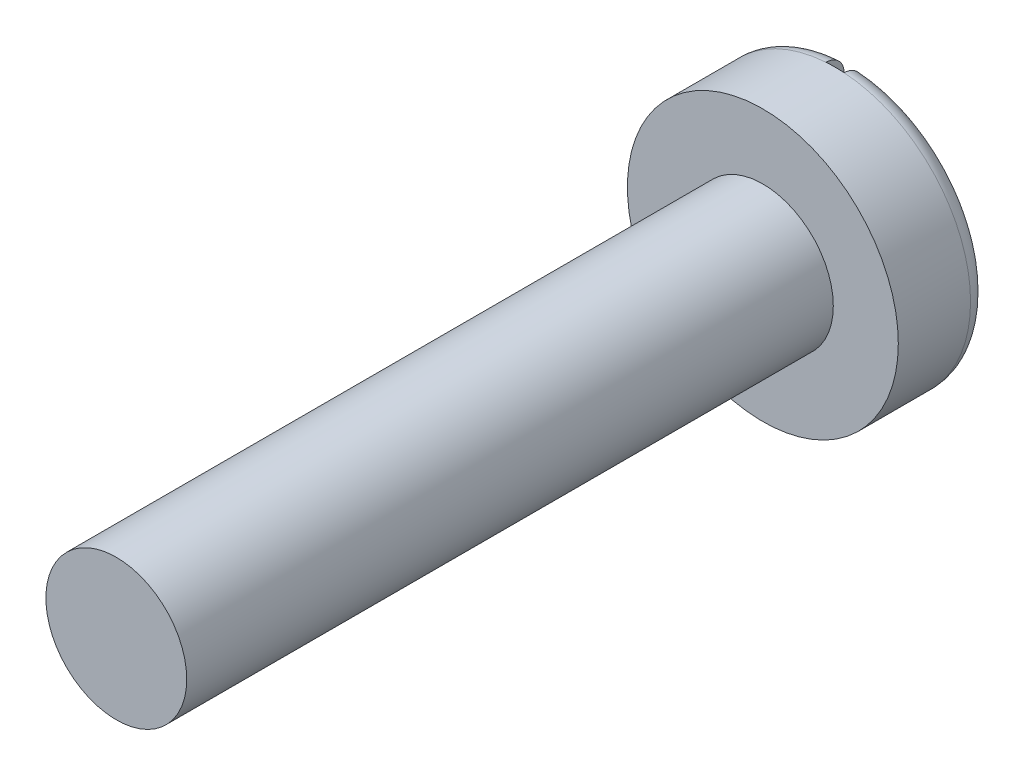
from build123d import *

# Parameters (mm, degrees)
CUT_EXTRUDE1_DEPTH = 0.254
FILLET1_R          = 0.254


with BuildPart() as part:
    # Sketch3 → Revolve1 (revolve)
    with BuildSketch(Plane(origin=(0, 0, 0), x_dir=(0, 0, -1), z_dir=(1, 0, 0)), mode=Mode.PRIVATE) as revolve1_sk:
        Polygon((0, 1.9049999999999998), (1.27, 1.9049999999999998), (1.27, 0), (0, 0), (-9.0932, 0), (-9.0932, 0.9905999999999988), (0, 0.9905999999999999), align=None)
    revolve(revolve1_sk.sketch.rotate(Axis((0, 0, 55.00000000000001), (0, 0, -1)), 90), axis=Axis((0, 0, 55.00000000000001), (0, 0, -1)))

    # Sketch4 → Cut-Extrude1 (cut)
    with BuildSketch(Plane(origin=(0, 0, -1.27), x_dir=(-1, 0, 0), z_dir=(0, 0, -1))):
        with BuildLine():
            Line((0, -1.9049999999999998), (0, 1.9049999999999998))
            ThreePointArc((1.2e-16, 1.9049999999999998), (-0.06353534655368165, 1.903940193319712), (-0.12700000000005424, 1.9007619524811585))
            Line((-0.127, 1.9007619524811548), (-0.127, -1.900761952481155))
            ThreePointArc((-0.12700000000005557, -1.9007619524811583), (-0.06353534655368254, -1.903940193319712), (-3.5e-16, -1.9049999999999998))
        make_face()
        with BuildLine():
            ThreePointArc((0.12700000000002576, 1.9007619524811603), (0.06353534655366751, 1.9039401933197126), (1.2e-16, 1.9049999999999998))
            Line((0, 1.9049999999999998), (0, -1.9049999999999998))
            ThreePointArc((-3.5e-16, -1.9049999999999998), (0.06353534655366662, -1.9039401933197126), (0.12700000000002445, -1.9007619524811603))
            Line((0.127, -1.9007619524811585), (0.127, 1.9007619524811585))
        make_face()
    extrude(amount=-CUT_EXTRUDE1_DEPTH, mode=Mode.SUBTRACT)

    # Fillet1
    fillet1_edges = [part.edges().sort_by_distance(p)[0] for p in [
        (-1.9049999999999998, -4.4e-16, -1.2700000000000031),
        (1.391215296063131, 1.301362747276859, -1.2700000000000031),
    ]]
    fillet(fillet1_edges, radius=FILLET1_R)


solid = part.part
